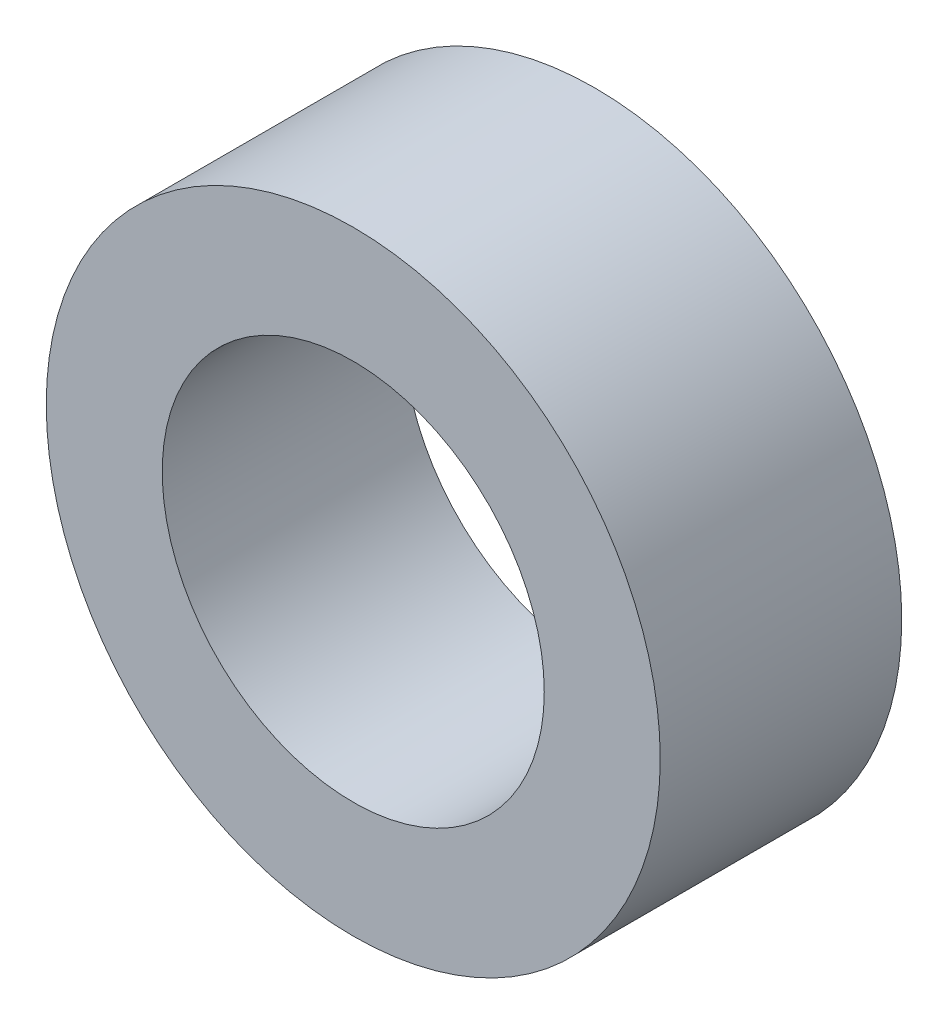
from build123d import *

# Parameters (mm, degrees)
CROQUIS1_R              = 22.5
SALIENTE_EXTRUIR1_DEPTH = 17.7
CROQUIS2_R              = 14
CORTAR_EXTRUIR1_DEPTH   = 17.7


with BuildPart() as part:
    # Croquis1 → Saliente-Extruir1 (new body)
    with BuildSketch(Plane.XY):
        Circle(CROQUIS1_R)
    extrude(amount=SALIENTE_EXTRUIR1_DEPTH)

    # Croquis2 → Cortar-Extruir1 (cut)
    with BuildSketch(Plane.XY.offset(17.7)):
        Circle(CROQUIS2_R)
    extrude(amount=-CORTAR_EXTRUIR1_DEPTH, mode=Mode.SUBTRACT)


solid = part.part
